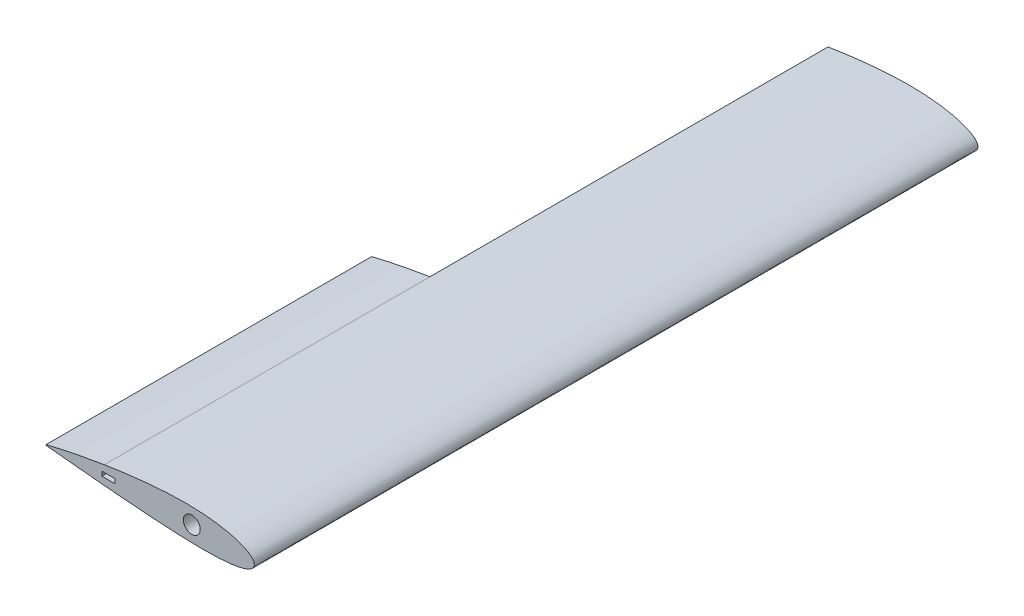
from build123d import *

# Parameters (mm, degrees)
BOSS_EXTRUDE1_DEPTH = 1120
BOSS_EXTRUDE2_DEPTH = 504
SKETCH3_R           = 13
CUT_EXTRUDE1_DEPTH  = 801
SKETCH4_W           = 32
SKETCH4_H           = 40.882
CUT_EXTRUDE2_DEPTH  = 46
SKETCH5_W           = 60
SKETCH5_H           = 12
CUT_EXTRUDE3_DEPTH  = 46
SKETCH6_W           = 54
SKETCH6_H           = 29.1
CUT_EXTRUDE4_DEPTH  = 64
SKETCH7_W           = 20.4
SKETCH7_H           = 6.8
CUT_EXTRUDE5_DEPTH  = 26
SKETCH8_W           = 20
SKETCH8_H           = 4
CUT_EXTRUDE6_DEPTH  = 20


with BuildPart() as part:
    # Sketch1 → Boss-Extrude1 (new body)
    with BuildSketch(Plane.XY):
        with BuildLine():
            Line((-232.07976, 18.640331755), (-232.07976, -9.299539429))
            add(Edge.make_bspline(
                [(-232.07976, 18.640331755), (-229.164273263, 19.105137392), (-222.291133752, 20.200897474), (-211.337542784, 21.800276655), (-199.146674743, 23.458907068), (-186.709533826, 24.99775787), (-174.104063941, 26.396384265), (-161.408619673, 27.628181699), (-148.702826871, 28.669998803), (-136.048616227, 29.498668375), (-123.502304929, 30.100378699), (-111.141296499, 30.381034684), (-99.066442851, 30.337763188), (-87.381824011, 29.96392256), (-76.165988678, 29.262541202), (-65.494170353, 28.242118376), (-55.437562328, 26.917551706), (-46.062520993, 25.309550624), (-37.429846456, 23.444065126), (-29.594109363, 21.3513396), (-22.603015821, 19.064676337), (-16.496733591, 16.618893003), (-11.307130205, 14.048195179), (-7.056738632, 11.383320116), (-3.758682454, 8.645345207), (-1.421067217, 5.837729222), (-0.076519927, 2.93397469), (0.175352503, -0.017611891), (-0.655158047, -2.858555013), (-2.530689177, -5.439611815), (-5.336827593, -7.743904666), (-9.03994776, -9.814562437), (-13.624875961, -11.664753347), (-19.070291538, -13.294987869), (-25.346462309, -14.70103051), (-32.416774291, -15.879078453), (-40.239338685, -16.827563542), (-48.768060709, -17.548259209), (-57.953346605, -18.046825288), (-67.742561923, -18.333070043), (-78.080327008, -18.420905027), (-88.908707336, -18.328114372), (-100.167316867, -18.075575791), (-111.793460515, -17.687481617), (-123.745328455, -17.185705506), (-135.973510615, -16.604056476), (-148.402819763, -15.890368868), (-160.93563744, -15.074548453), (-173.478390843, -14.17792148), (-185.955186825, -13.221857076), (-198.290086365, -12.225761595), (-210.407470499, -11.20618891), (-221.646872664, -10.232436467), (-228.837861155, -9.589426373), (-232.07976, -9.299539429)],
                knots=[0, 0, 0, 0, 0.018424224, 0.043434346, 0.069080412, 0.095203092, 0.121640117, 0.148227444, 0.17480049, 0.201195447, 0.227363977, 0.253181792, 0.278347264, 0.302710399, 0.326128333, 0.348466602, 0.369600377, 0.389415723, 0.407811011, 0.424698681, 0.44000774, 0.453687637, 0.465714725, 0.476103672, 0.484928355, 0.492360154, 0.498730164, 0.504586951, 0.510443348, 0.516803825, 0.524198712, 0.532940661, 0.543185695, 0.554995644, 0.568376342, 0.583298542, 0.599709376, 0.617538825, 0.636703502, 0.65710892, 0.678650912, 0.701216586, 0.724685048, 0.748928058, 0.7738107, 0.799337901, 0.825325561, 0.851504471, 0.877716004, 0.903800001, 0.929595993, 0.954944401, 0.979687675, 1, 1, 1, 1], degree=3))
        make_face()
    extrude(amount=-BOSS_EXTRUDE1_DEPTH)

    # Sketch2 → Boss-Extrude2 (add)
    with BuildSketch(Plane.XY):
        with BuildLine():
            Line((-232.07976, 18.640331755), (-232.07976, -9.299539429))
            add(Edge.make_bspline(
                [(-232.07976, -9.299539429), (-232.665749528, -9.247457079), (-236.934557579, -8.868048329), (-244.715948926, -8.155780655), (-255.233547628, -7.182675415), (-265.178963193, -6.244796096), (-274.489444659, -5.35296602), (-283.105666868, -4.514522896), (-290.972478934, -3.737169374), (-298.039247191, -3.028597089), (-304.260184667, -2.39533485), (-309.594932862, -1.846814612), (-314.008232694, -1.38276071), (-317.472079994, -1.027677658), (-319.961203892, -0.741044399), (-321.464120443, -0.620061141), (-322.14198951, -0.505870173), (-322.321741193, -0.506509982), (-322.333, -0.506550056)],
                knots=[0, 0, 0, 0, 0.019462551, 0.14178051, 0.258505433, 0.368899529, 0.472261554, 0.567931303, 0.655293986, 0.733784513, 0.802891701, 0.862162346, 0.911205133, 0.949694244, 0.977372582, 0.994054454, 0.999627599, 1, 1, 1, 1], degree=3))
            Line((-322.333, -0.506550056), (-322.333, 0.514797488))
            add(Edge.make_bspline(
                [(-232.07976, 18.640331755), (-232.997104276, 18.496640375), (-237.59945591, 17.775735177), (-245.697898879, 16.398726282), (-256.18174484, 14.549633525), (-266.070518156, 12.708392515), (-275.306517101, 10.911856103), (-283.834257123, 9.183893288), (-291.603294753, 7.551136168), (-298.567863892, 6.038773121), (-304.687234469, 4.671058189), (-309.925850109, 3.470601356), (-314.253461721, 2.457844833), (-317.645235976, 1.650544318), (-320.081782459, 1.063070488), (-321.538022536, 0.709024901), (-322.180548986, 0.552044036), (-322.333, 0.514797488)],
                knots=[0, 0, 0, 0, 0.030251696, 0.151773928, 0.267626296, 0.377089872, 0.479484952, 0.574174897, 0.660569789, 0.738129949, 0.806369318, 0.864858701, 0.913228834, 0.951173208, 0.978450569, 0.994887008, 1, 1, 1, 1], degree=3))
        make_face()
    extrude(amount=-BOSS_EXTRUDE2_DEPTH)

    # Sketch3 → Cut-Extrude1 (cut)
    with BuildSketch(Plane.XY):
        with Locations((-96.7, 6.044)):
            Circle(SKETCH3_R)
    extrude(amount=-CUT_EXTRUDE1_DEPTH, mode=Mode.SUBTRACT)

    # Sketch4 → Cut-Extrude2 (cut)
    with BuildSketch(Plane.XY.offset(-376.7)):
        with Locations((-96.7, 1.303)):
            Rectangle(SKETCH4_W, SKETCH4_H)
    extrude(amount=CUT_EXTRUDE2_DEPTH, mode=Mode.SUBTRACT)

    # Sketch5 → Cut-Extrude3 (cut)
    with BuildSketch(Plane.XY.offset(-376.7)):
        with Locations((-257.8664, -2.987)):
            Rectangle(SKETCH5_W, SKETCH5_H)
    extrude(amount=CUT_EXTRUDE3_DEPTH, mode=Mode.SUBTRACT)

    # Sketch6 → Cut-Extrude4 (cut)
    with BuildSketch(Plane.XY.offset(-598.5)):
        with Locations((-177.283, -2.36)):
            Rectangle(SKETCH6_W, SKETCH6_H)
    extrude(amount=CUT_EXTRUDE4_DEPTH, mode=Mode.SUBTRACT)

    # Sketch7 → Cut-Extrude5 (cut)
    with BuildSketch(Plane.XY.offset(-25.5)):
        with Locations((-225.633, 4.835)):
            Rectangle(SKETCH7_W, SKETCH7_H)
    extrude(amount=CUT_EXTRUDE5_DEPTH, mode=Mode.SUBTRACT)

    # Sketch8 → Cut-Extrude6 (cut)
    with BuildSketch(Plane.XY.offset(-930)):
        with Locations((-50, -17.343)):
            Rectangle(SKETCH8_W, SKETCH8_H)
    extrude(amount=CUT_EXTRUDE6_DEPTH, mode=Mode.SUBTRACT)


solid = part.part
